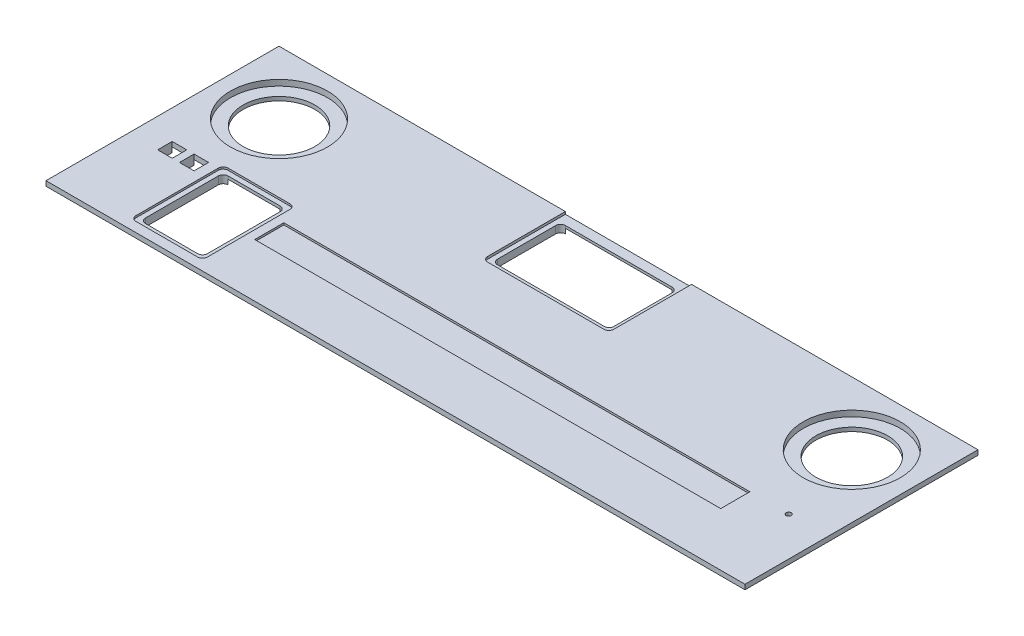
from build123d import *

# Parameters (mm, degrees)
SKETCH1_W           = 914.4
SKETCH1_H           = 304.8
BOSS_EXTRUDE1_DEPTH = 12.7
SKETCH5_W           = 609.6
SKETCH5_H           = 38.1
CUT_EXTRUDE3_DEPTH  = 2.54
SKETCH6_R           = 46.99
CUT_EXTRUDE4_DEPTH  = 964.945895785
SKETCH7_R           = 63.5
CUT_EXTRUDE5_DEPTH  = 7.62
CUT_EXTRUDE6_DEPTH  = 964.945895785
CUT_EXTRUDE7_DEPTH  = 3.175
SKETCH13_W          = 19.05
SKETCH13_H          = 19.05
CUT_EXTRUDE11_DEPTH = 964.945895785
CUT_EXTRUDE19_DEPTH = 964.945895785
CUT_EXTRUDE20_DEPTH = 2.54
SKETCH26_R          = 3.302
CUT_EXTRUDE21_DEPTH = 964.945895785
SKETCH19_W          = 914.4
SKETCH19_H          = 304.8
CUT_EXTRUDE16_DEPTH = 6.35


with BuildPart() as part:
    # Sketch1 → Boss-Extrude1 (new body)
    with BuildSketch(Plane(origin=(0, 0, 0), x_dir=(1, 0, 0), z_dir=(0, 1, 0))):
        with Locations((457.2, 152.4)):
            Rectangle(SKETCH1_W, SKETCH1_H)
    extrude(amount=BOSS_EXTRUDE1_DEPTH)

    # Sketch5 → Cut-Extrude3 (cut)
    with BuildSketch(Plane(origin=(0, 12.7, 0), x_dir=(1, 0, 0), z_dir=(0, 1, 0))):
        with Locations((508, 88.9)):
            Rectangle(SKETCH5_W, SKETCH5_H)
    extrude(amount=-CUT_EXTRUDE3_DEPTH, mode=Mode.SUBTRACT)

    # Sketch6 → Cut-Extrude4 (cut, through all)
    with BuildSketch(Plane(origin=(0, 12.7, 0), x_dir=(1, 0, 0), z_dir=(0, 1, 0))):
        with Locations(Location((82.55, 222.25, 0), (0, 0, 270))):
            Circle(SKETCH6_R)
        with Locations(Location((831.85, 222.25, 0), (0, 0, 270))):
            Circle(SKETCH6_R)
    extrude(amount=-CUT_EXTRUDE4_DEPTH, mode=Mode.SUBTRACT)

    # Sketch7 → Cut-Extrude5 (cut)
    with BuildSketch(Plane(origin=(0, 12.7, 0), x_dir=(1, 0, 0), z_dir=(0, 1, 0))):
        with Locations(Location((82.55, 222.25, 0), (0, 0, 270))):
            Circle(SKETCH7_R)
        with Locations(Location((831.85, 222.25, 0), (0, 0, 270))):
            Circle(SKETCH7_R)
    extrude(amount=-CUT_EXTRUDE5_DEPTH, mode=Mode.SUBTRACT)

    # Sketch8 → Cut-Extrude6 (cut, through all)
    with BuildSketch(Plane(origin=(0, 12.7, 0), x_dir=(1, 0, 0), z_dir=(0, 1, 0))):
        with BuildLine():
            Line((381, 285.75), (381, 209.55))
            ThreePointArc((381, 209.55), (382.859871939, 205.059871939), (387.35, 203.2))
            Line((387.35, 203.2), (527.05, 203.2))
            ThreePointArc((527.05, 203.2), (531.540128061, 205.059871939), (533.4, 209.55))
            Line((533.4, 209.55), (533.4, 285.75))
            ThreePointArc((533.4, 285.75), (531.540128061, 290.240128061), (527.05, 292.1))
            Line((527.05, 292.1), (387.35, 292.1))
            ThreePointArc((387.35, 292.1), (382.859871939, 290.240128061), (381, 285.75))
        make_face()
    extrude(amount=-CUT_EXTRUDE6_DEPTH, mode=Mode.SUBTRACT)

    # Sketch9 → Cut-Extrude7 (cut)
    with BuildSketch(Plane(origin=(0, 12.7, 0), x_dir=(1, 0, 0), z_dir=(0, 1, 0))):
        with BuildLine():
            Line((539.75, 304.8), (374.65, 304.8))
            Line((374.65, 304.8), (374.65, 202.946))
            ThreePointArc((374.65, 202.946), (376.509871939, 198.455871939), (381, 196.596))
            Line((381, 196.596), (533.4, 196.596))
            ThreePointArc((533.4, 196.596), (537.890128061, 198.455871939), (539.75, 202.946))
            Line((539.75, 202.946), (539.75, 304.8))
        make_face()
    extrude(amount=-CUT_EXTRUDE7_DEPTH, mode=Mode.SUBTRACT)

    # Sketch13 → Cut-Extrude11 (cut, through all)
    with BuildSketch(Plane(origin=(0, 12.7, 0), x_dir=(1, 0, 0), z_dir=(0, 1, 0))):
        with Locations((47.625, 117.475)):
            Rectangle(SKETCH13_W, SKETCH13_H)
        with Locations((76.2, 117.475)):
            Rectangle(SKETCH13_W, SKETCH13_H)
    extrude(amount=-CUT_EXTRUDE11_DEPTH, mode=Mode.SUBTRACT)

    # Sketch24 → Cut-Extrude19 (cut, through all)
    with BuildSketch(Plane(origin=(0, 12.7, 0), x_dir=(1, 0, 0), z_dir=(0, 1, 0))):
        with BuildLine():
            Line((111.125, 127), (179.3875, 127))
            ThreePointArc((179.3875, 127), (183.877628061, 125.140128061), (185.7375, 120.65))
            Line((185.7375, 120.65), (185.7375, 25.4))
            ThreePointArc((185.7375, 25.4), (183.877628061, 20.909871939), (179.3875, 19.05))
            Line((179.3875, 19.05), (111.125, 19.05))
            ThreePointArc((111.125, 19.05), (106.634871939, 20.909871939), (104.775, 25.4))
            Line((104.775, 25.4), (104.775, 120.65))
            ThreePointArc((104.775, 120.65), (106.634871939, 125.140128061), (111.125, 127))
        make_face()
    extrude(amount=-CUT_EXTRUDE19_DEPTH, mode=Mode.SUBTRACT)

    # Sketch25 → Cut-Extrude20 (cut)
    with BuildSketch(Plane(origin=(0, 12.7, 0), x_dir=(1, 0, 0), z_dir=(0, 1, 0))):
        with BuildLine():
            Line((104.775, 133.35), (185.7375, 133.35))
            ThreePointArc((185.7375, 133.35), (190.227628061, 131.490128061), (192.0875, 127))
            Line((192.0875, 127), (192.0875, 19.05))
            ThreePointArc((192.0875, 19.05), (190.227628061, 14.559871939), (185.7375, 12.7))
            Line((185.7375, 12.7), (104.775, 12.7))
            ThreePointArc((104.775, 12.7), (100.284871939, 14.559871939), (98.425, 19.05))
            Line((98.425, 19.05), (98.425, 127))
            ThreePointArc((98.425, 127), (100.284871939, 131.490128061), (104.775, 133.35))
        make_face()
    extrude(amount=-CUT_EXTRUDE20_DEPTH, mode=Mode.SUBTRACT)

    # Sketch26 → Cut-Extrude21 (cut, through all)
    with BuildSketch(Plane(origin=(0, 12.7, 0), x_dir=(1, 0, 0), z_dir=(0, 1, 0))):
        with Locations(Location((863.6, 107.95, 0), (0, 0, 270))):
            Circle(SKETCH26_R)
    extrude(amount=-CUT_EXTRUDE21_DEPTH, mode=Mode.SUBTRACT)

    # Sketch19 → Cut-Extrude16 (cut)
    with BuildSketch(Plane.XZ):
        with Locations((457.2, -152.4)):
            Rectangle(SKETCH19_W, SKETCH19_H)
        with BuildLine():
            Line((12.7, -139.7), (12.7, -292.1))
            Line((12.7, -292.1), (317.5, -292.1))
            Line((317.5, -292.1), (317.5, -146.05))
            ThreePointArc((317.5, -146.05), (315.640128061, -141.559871939), (311.15, -139.7))
            Line((311.15, -139.7), (12.7, -139.7))
        make_face(mode=Mode.SUBTRACT)
        with BuildLine():
            Line((596.9, -292.1), (901.7, -292.1))
            Line((901.7, -292.1), (901.7, -139.7))
            Line((901.7, -139.7), (603.25, -139.7))
            ThreePointArc((603.25, -139.7), (598.759871939, -141.559871939), (596.9, -146.05))
            Line((596.9, -146.05), (596.9, -292.1))
        make_face(mode=Mode.SUBTRACT)
        with BuildLine():
            Line((12.7, -127), (12.7, -12.7))
            Line((12.7, -12.7), (901.7, -12.7))
            Line((901.7, -12.7), (901.7, -127))
            Line((901.7, -127), (590.55, -127))
            ThreePointArc((590.55, -127), (586.059871939, -128.859871939), (584.2, -133.35))
            Line((584.2, -133.35), (584.2, -292.1))
            Line((584.2, -292.1), (330.2, -292.1))
            Line((330.2, -292.1), (330.2, -133.35))
            ThreePointArc((330.2, -133.35), (328.340128061, -128.859871939), (323.85, -127))
            Line((323.85, -127), (12.7, -127))
        make_face(mode=Mode.SUBTRACT)
    extrude(amount=-CUT_EXTRUDE16_DEPTH, mode=Mode.SUBTRACT)


solid = part.part
